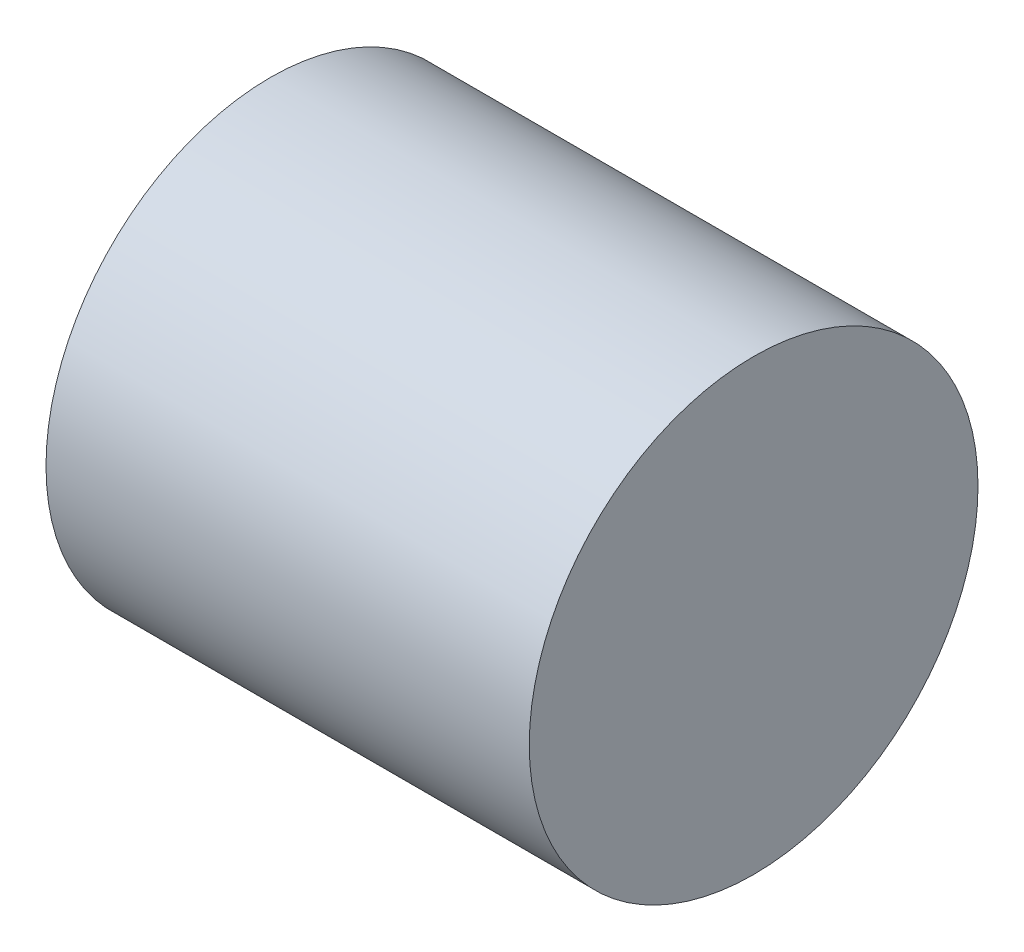
from build123d import *

# Parameters (mm, degrees)
SKETCH_1_R      = 3.25
EXTRUDE_1_DEPTH = 7


with BuildPart() as part:
    # 草图1 → 凸台-拉伸1 (new body)
    with BuildSketch(Plane(origin=(0, 0, 0), x_dir=(0, 0, -1), z_dir=(1, 0, 0))):
        Circle(SKETCH_1_R)
    extrude(amount=EXTRUDE_1_DEPTH)


solid = part.part
